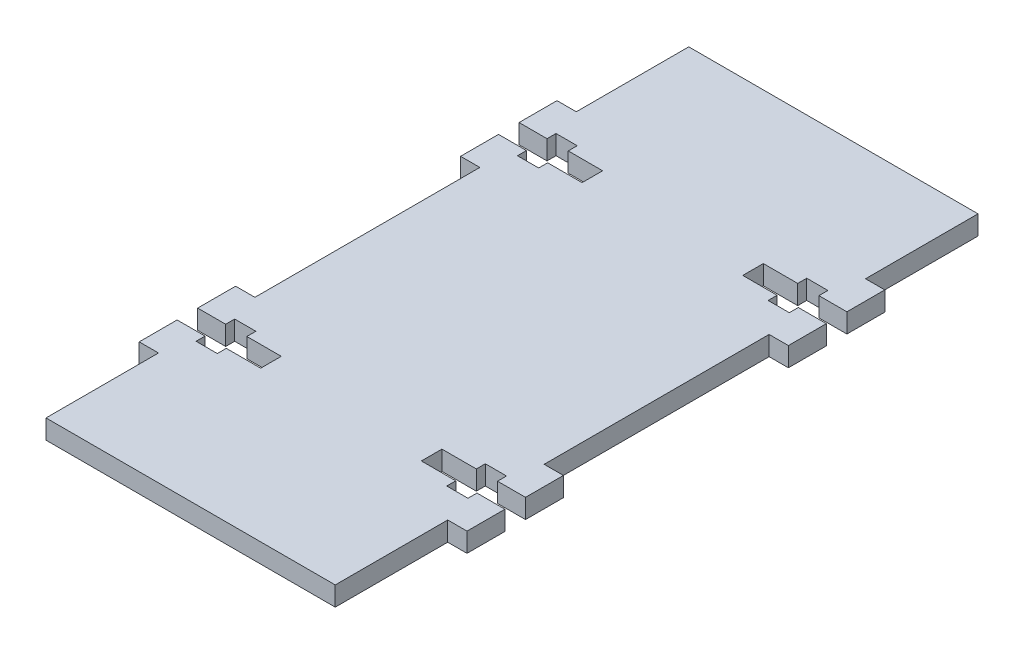
from build123d import *

# Parameters (mm, degrees)
SKETCH_1_W                 = 45
SKETCH_1_H                 = 100
SKETCH_1_W_2               = 3
SKETCH_1_H_2               = 15
EXTRUDE_1_DEPTH            = 1.5
SKETCH_2_W                 = 5.35
SKETCH_2_H                 = 3.2
SKETCH_2_W_2               = 3.3
SKETCH_2_H_2               = 1.4
SKETCH_2_W_3               = 4.35
CUT_EXTRUDE_1_DEPTH        = 57.207205944
MIRROR_2_COPY_1_SKETCH_W   = 5.35
MIRROR_2_COPY_1_SKETCH_H   = 3.2
MIRROR_2_COPY_1_SKETCH_W_2 = 3.3
MIRROR_2_COPY_1_SKETCH_H_2 = 1.4
MIRROR_2_COPY_1_SKETCH_W_3 = 4.35
MIRROR_2_COPY_1_DEPTH      = 57.207205944


with BuildPart() as part:
    # 草图1 → 凸台-拉伸1 (new, symmetric)
    with BuildSketch(Plane(origin=(0, 0, 0), x_dir=(1, 0, 0), z_dir=(0, 1, 0))):
        Rectangle(SKETCH_1_W, SKETCH_1_H)
        with Locations((-24, 25)):
            Rectangle(SKETCH_1_W_2, SKETCH_1_H_2)
        with Locations((-24, -25)):
            Rectangle(SKETCH_1_W_2, SKETCH_1_H_2)
        with Locations((24, -25)):
            Rectangle(SKETCH_1_W_2, SKETCH_1_H_2)
        with Locations((24, 25)):
            Rectangle(SKETCH_1_W_2, SKETCH_1_H_2)
    extrude(amount=EXTRUDE_1_DEPTH, both=True)

    # 草图2 → 切除-拉伸1 (cut, symmetric)
    with BuildSketch(Plane(origin=(0, 1.5, 0), x_dir=(1, 0, 0), z_dir=(0, 1, 0))):
        with Locations((15.175, 25)):
            Rectangle(SKETCH_2_W, SKETCH_2_H)
        with Locations((19.5, 27.3)):
            Rectangle(SKETCH_2_W_2, SKETCH_2_H_2)
        with Locations((19.5, 25)):
            Rectangle(SKETCH_2_W_2, SKETCH_2_H)
        with Locations((19.5, 22.7)):
            Rectangle(SKETCH_2_W_2, SKETCH_2_H_2)
        with Locations((23.325, 25)):
            Rectangle(SKETCH_2_W_3, SKETCH_2_H)
    cut_extrude_1 = extrude(amount=CUT_EXTRUDE_1_DEPTH, both=True, mode=Mode.SUBTRACT)

    # 镜向1: 切除-拉伸1 across plane
    add(cut_extrude_1.mirror(Plane(origin=(0, 0, 0), x_dir=(0, 0, 1), z_dir=(1, 0, 0))), mode=Mode.SUBTRACT)

    # 镜向2: 切除-拉伸1 across plane
    add(cut_extrude_1.mirror(Plane.XY), mode=Mode.SUBTRACT)

    # 镜向2 copy 1 sketch → 镜向2 copy 1 (cut, symmetric)
    with BuildSketch(Plane(origin=(0, 1.5, 0), x_dir=(-1, 0, 0), z_dir=(0, 1, 0))):
        with Locations((15.175, 25)):
            Rectangle(MIRROR_2_COPY_1_SKETCH_W, MIRROR_2_COPY_1_SKETCH_H)
        with Locations((19.5, 27.3)):
            Rectangle(MIRROR_2_COPY_1_SKETCH_W_2, MIRROR_2_COPY_1_SKETCH_H_2)
        with Locations((19.5, 25)):
            Rectangle(MIRROR_2_COPY_1_SKETCH_W_2, MIRROR_2_COPY_1_SKETCH_H)
        with Locations((19.5, 22.7)):
            Rectangle(MIRROR_2_COPY_1_SKETCH_W_2, MIRROR_2_COPY_1_SKETCH_H_2)
        with Locations((23.325, 25)):
            Rectangle(MIRROR_2_COPY_1_SKETCH_W_3, MIRROR_2_COPY_1_SKETCH_H)
    extrude(amount=MIRROR_2_COPY_1_DEPTH, both=True, mode=Mode.SUBTRACT)


solid = part.part
